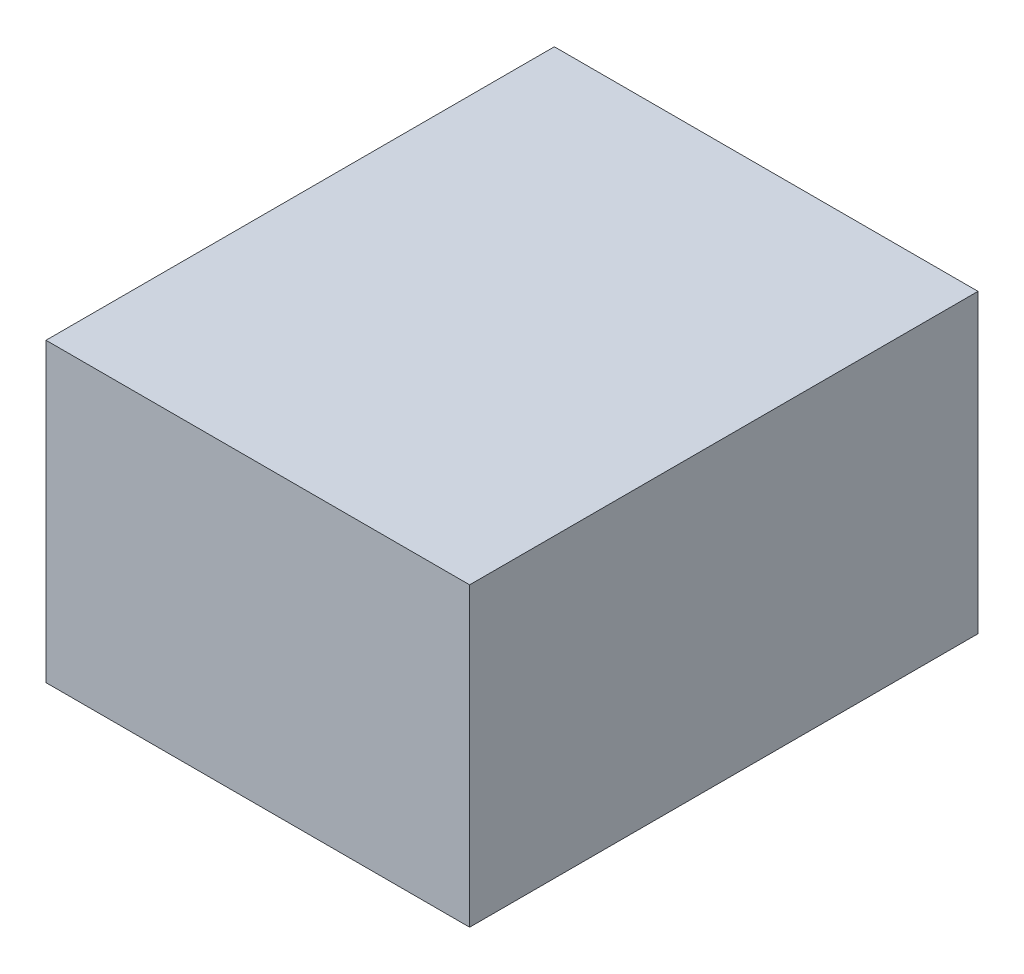
from build123d import *

# Parameters (mm, degrees)
SKETCH1_W           = 31.75
SKETCH1_H           = 38.1
BOSS_EXTRUDE1_DEPTH = 22.225


with BuildPart() as part:
    # Sketch1 → Boss-Extrude1 (new body)
    with BuildSketch(Plane(origin=(0, 0, 0), x_dir=(1, 0, 0), z_dir=(0, 1, 0))):
        with Locations((15.875, 19.05)):
            Rectangle(SKETCH1_W, SKETCH1_H)
    extrude(amount=BOSS_EXTRUDE1_DEPTH)


solid = part.part
